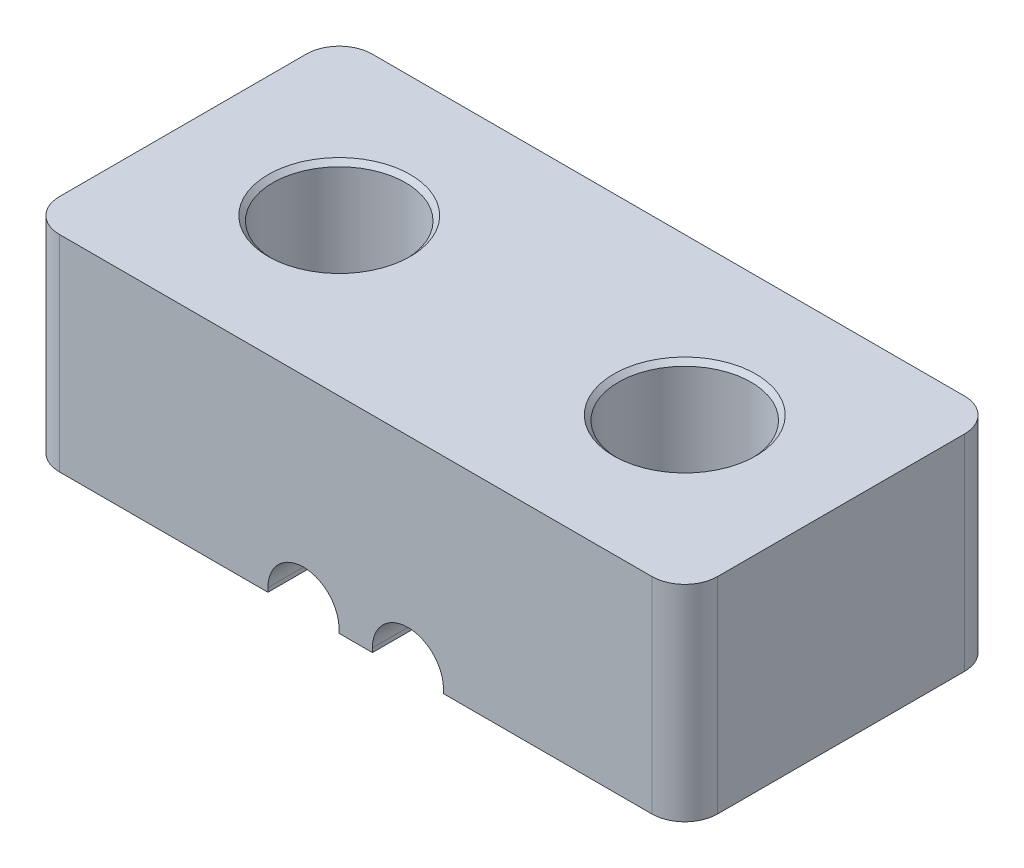
from build123d import *

# Parameters (mm, degrees)
SKETCH1_W                             = 8
SKETCH1_H                             = 3.8
BE_01_BOSS_EXTRUDE_DEPTH              = 2.5
CE_01_CLAMP_GROOVES_DEPTH             = 3
F_52_0_0635_DIAMETER_HOLE1_AT_2_COUNT = 2
F_52_0_0635_DIAMETER_HOLE1_AT_2_PITCH = 4.2
FILLET1_R                             = 0.4


with BuildPart() as part:
    # Sketch1 → BE-01 Boss Extrude (new body)
    with BuildSketch(Plane(origin=(0, 0, 0), x_dir=(1, 0, 0), z_dir=(0, 1, 0))):
        Rectangle(SKETCH1_W, SKETCH1_H)
    extrude(amount=BE_01_BOSS_EXTRUDE_DEPTH)

    # Sketch2 → CE-01 Clamp Grooves (cut, symmetric)
    with BuildSketch(Plane.XY):
        with BuildLine():
            Line((-6.978653293, -2.49), (-6.978653293, -4.211330321))
            Line((-6.978653293, -4.211330321), (6.978653293, -4.211330321))
            Line((6.978653293, -4.211330321), (6.978653293, -2.49))
            Line((6.978653293, -2.49), (1.0668, -2.49))
            Line((1.0668, -2.49), (1.0668, 0.05))
            ThreePointArc((1.0668, 0.05), (0.635, 0.4818), (0.2032, 0.05))
            Line((0.2032, 0.05), (0.2032, -2.49))
            Line((0.2032, -2.49), (-0.2032, -2.49))
            Line((-0.2032, -2.49), (-0.2032, 0.05))
            ThreePointArc((-0.2032, 0.05), (-0.635, 0.4818), (-1.0668, 0.05))
            Line((-1.0668, 0.05), (-1.0668, -2.49))
            Line((-1.0668, -2.49), (-6.978653293, -2.49))
        make_face()
    extrude(amount=CE_01_CLAMP_GROOVES_DEPTH, both=True, mode=Mode.SUBTRACT)

    # Sketch4 → #52 (0.0635) Diameter Hole1 (revolve, cut)
    with BuildSketch(Plane(origin=(-2.1, 2.5, 0), x_dir=(0, 0, 1), z_dir=(1, 0, 0))):
        Polygon((0, 0), (0, 2.5), (0.8636, 2.5), (0.80645, 2.44285), (0.80645, 0.05715), (0.8636, 0), align=None)
    f_52_0_0635_diameter_hole1 = revolve(axis=Axis((-2.1, 8.85, 0), (0, -1, 0)), mode=Mode.SUBTRACT)

    # #52 (0.0635) Diameter Hole1 at 2: #52 (0.0635) Diameter Hole1 ×2
    with Locations(*[(i * F_52_0_0635_DIAMETER_HOLE1_AT_2_PITCH, 0, 0) for i in range(1, F_52_0_0635_DIAMETER_HOLE1_AT_2_COUNT)]):
        add(f_52_0_0635_diameter_hole1, mode=Mode.SUBTRACT)

    # Fillet1
    fillet1_edges = [part.edges().sort_by_distance(p)[0] for p in [
        (-4, 1.25, -1.9),
        (4, 1.25, -1.9),
        (4, 1.25, 1.9),
        (-4, 1.25, 1.9),
    ]]
    fillet(fillet1_edges, radius=FILLET1_R)


solid = part.part
